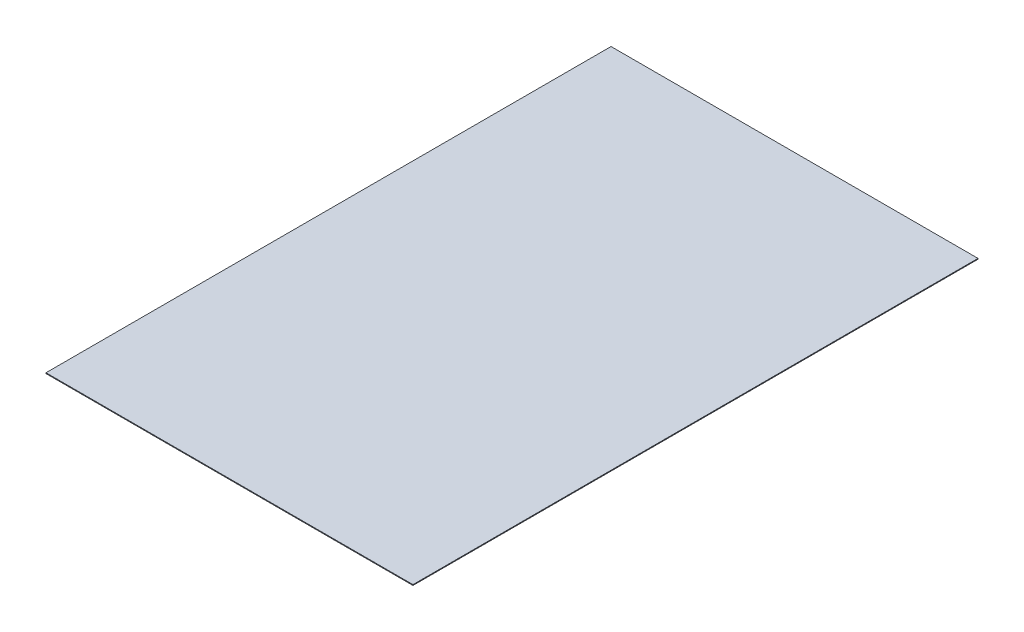
from build123d import *

# Parameters (mm, degrees)
SKETCH1_W           = 239
SKETCH1_H           = 368
BOSS_EXTRUDE1_DEPTH = 0.5


with BuildPart() as part:
    # Sketch1 → Boss-Extrude1 (new body)
    with BuildSketch(Plane(origin=(0, 0, 0), x_dir=(1, 0, 0), z_dir=(0, 1, 0))):
        with Locations((119.5, 184)):
            Rectangle(SKETCH1_W, SKETCH1_H)
    extrude(amount=BOSS_EXTRUDE1_DEPTH)


solid = part.part
